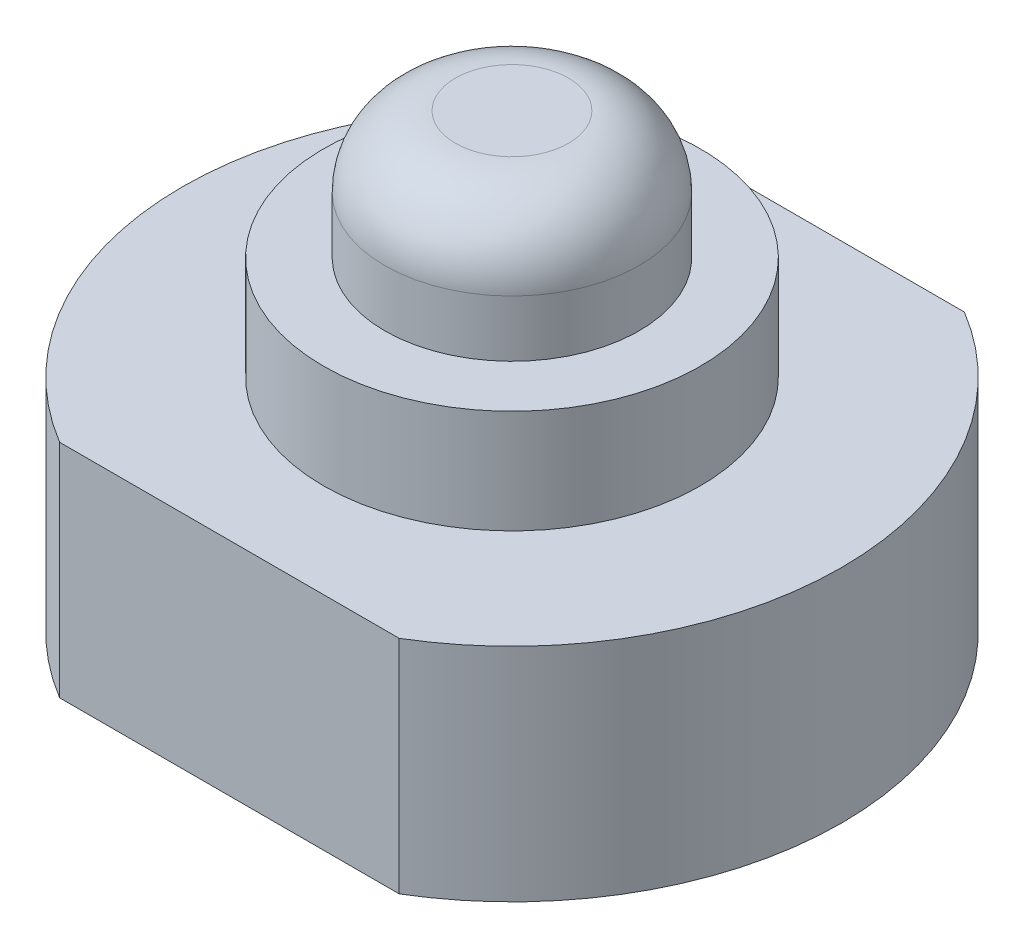
from build123d import *

# Parameters (mm, degrees)
BOSS_EXTRUDE1_DEPTH = 4.7
SKETCH2_R           = 4
BOSS_EXTRUDE2_DEPTH = 2.2
SKETCH3_R           = 2.7
BOSS_EXTRUDE3_DEPTH = 2.7
FILLET1_R           = 1.5


with BuildPart() as part:
    # Sketch1 → Boss-Extrude1 (new body)
    with BuildSketch(Plane(origin=(0, 0, 0), x_dir=(1, 0, 0), z_dir=(0, 1, 0))):
        with BuildLine():
            Line((-3.60441458, 6), (3.60558542, 6))
            ThreePointArc((3.60558542, 6), (7.00058542, 0), (3.60558542, -6))
            Line((3.60558542, -6), (-3.60441458, -6))
            ThreePointArc((-3.60441458, -6), (-6.99941458, 0), (-3.60441458, 6))
        make_face()
    extrude(amount=BOSS_EXTRUDE1_DEPTH)

    # Sketch2 → Boss-Extrude2 (add)
    with BuildSketch(Plane(origin=(0, 4.7, 0), x_dir=(1, 0, 0), z_dir=(0, 1, 0))):
        with Locations(Location((0, 0, 0), (0, 0, 270))):
            Circle(SKETCH2_R)
    extrude(amount=BOSS_EXTRUDE2_DEPTH)

    # Sketch3 → Boss-Extrude3 (add)
    with BuildSketch(Plane(origin=(0, 6.9, 0), x_dir=(1, 0, 0), z_dir=(0, 1, 0))):
        with Locations(Location((0, 0, 0), (0, 0, 270))):
            Circle(SKETCH3_R)
    extrude(amount=BOSS_EXTRUDE3_DEPTH)

    # Fillet1
    fillet1_edges = [part.edges().sort_by_distance(p)[0] for p in [
        (0, 9.6, -2.7),
    ]]
    fillet(fillet1_edges, radius=FILLET1_R)


solid = part.part
